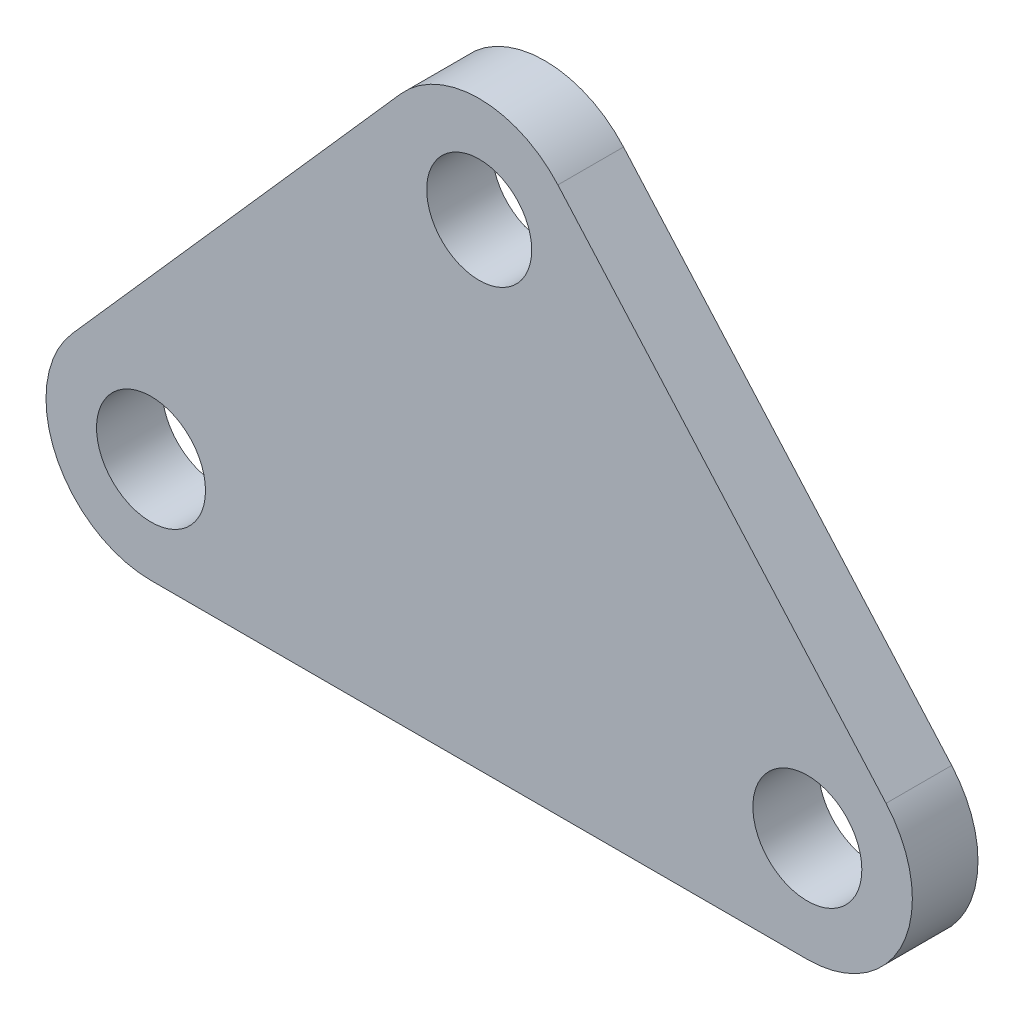
from build123d import *

# Parameters (mm, degrees)
SKETCH1_R           = 4
SKETCH1_R_2         = 4.15
BOSS_EXTRUDE2_DEPTH = 5


with BuildPart() as part:
    # Sketch1 → Boss-Extrude2 (new body)
    # profile 1 of 2: a face of its own
    with BuildSketch(Plane.XY):
        with BuildLine():
            Line((-25, -20.3), (25, -20.3))
            ThreePointArc((25, -20.3), (28.288479467, -21.007133431), (30.995610492, -23.003524301))
            Line((30.995610492, -23.003524301), (5.995610492, 5.296475699))
            ThreePointArc((5.995610492, 5.296475699), (0, 8), (-5.995610492, 5.296475699))
            Line((-5.995610492, 5.296475699), (-30.995610492, -23.003524301))
            ThreePointArc((-30.995610492, -23.003524301), (-28.288479467, -21.007133431), (-25, -20.3))
        make_face()
        Circle(SKETCH1_R, mode=Mode.SUBTRACT)
    # profile 2 of 2: a face of its own
    with BuildSketch(Plane.XY):
        with BuildLine():
            ThreePointArc((25, -20.3), (28.288479467, -21.007133431), (30.995610492, -23.003524301))
            ThreePointArc((30.995610492, -23.003524301), (32.292866569, -31.588479467), (25, -36.3))
            Line((25, -36.3), (-25, -36.3))
            ThreePointArc((-25, -36.3), (-32.292866569, -31.588479467), (-30.995610492, -23.003524301))
            ThreePointArc((-30.995610492, -23.003524301), (-28.288479467, -21.007133431), (-25, -20.3))
            Line((-25, -20.3), (25, -20.3))
        make_face()
        with Locations((-25, -28.3)):
            Circle(SKETCH1_R_2, mode=Mode.SUBTRACT)
        with Locations((25, -28.3)):
            Circle(SKETCH1_R_2, mode=Mode.SUBTRACT)
    extrude(amount=-BOSS_EXTRUDE2_DEPTH)


solid = part.part
